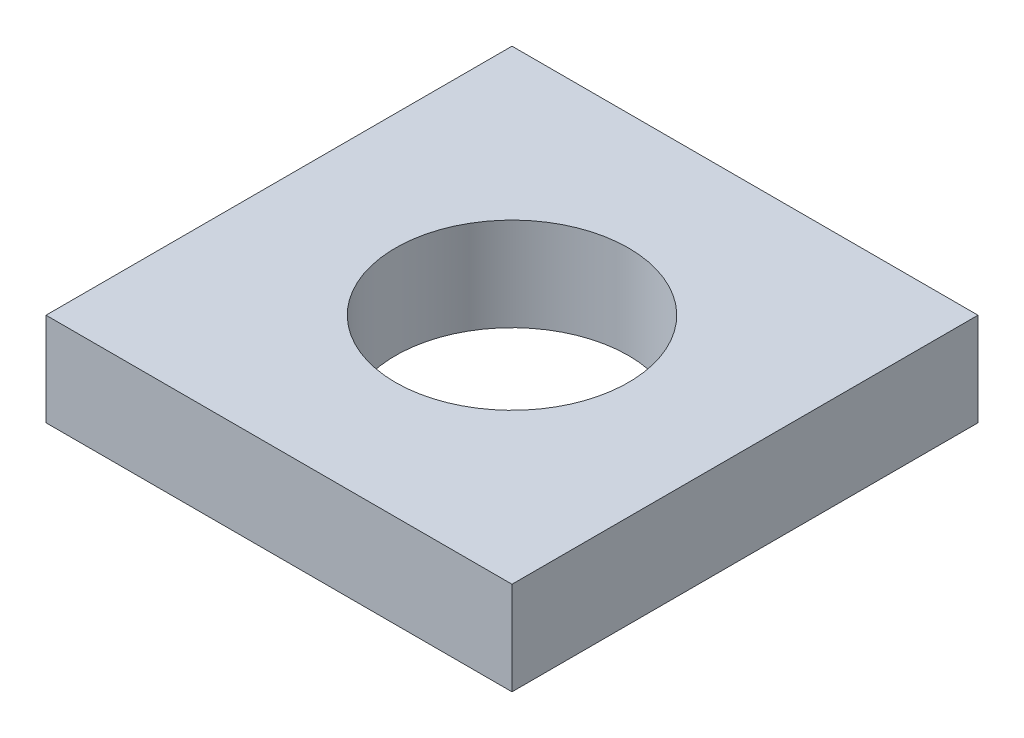
from build123d import *

# Parameters (mm, degrees)
SKETCH1_W           = 12.7
SKETCH1_H           = 12.7
SKETCH1_R           = 3.175
BOSS_EXTRUDE1_DEPTH = 2.54


with BuildPart() as part:
    # Sketch1 → Boss-Extrude1 (new body)
    with BuildSketch(Plane(origin=(0, 0, 0), x_dir=(1, 0, 0), z_dir=(0, 1, 0))):
        Rectangle(SKETCH1_W, SKETCH1_H)
        with Locations(Location((0, 0, 0), (0, 0, 270))):
            Circle(SKETCH1_R, mode=Mode.SUBTRACT)
    extrude(amount=BOSS_EXTRUDE1_DEPTH)


solid = part.part
